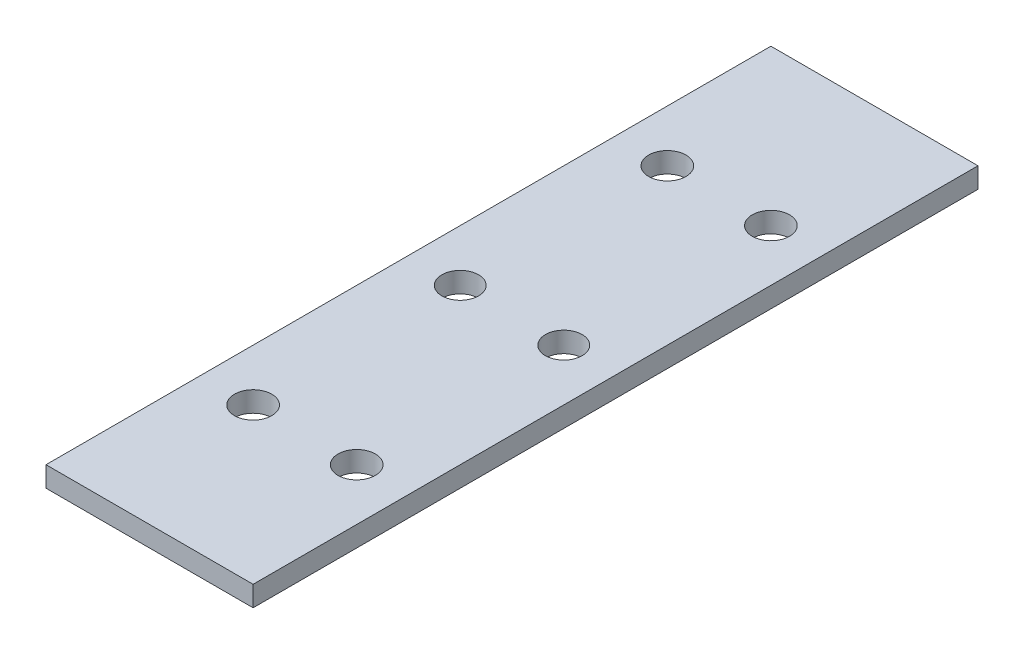
from build123d import *

# Parameters (mm, degrees)
SKETCH1_W           = 25.4
SKETCH1_H           = 88.9
SKETCH1_R           = 2.286
SKETCH1_R_2         = 2.25
BOSS_EXTRUDE1_DEPTH = 2.5


with BuildPart() as part:
    # Sketch1 → Boss-Extrude1 (new body)
    with BuildSketch(Plane(origin=(0, 0, 0), x_dir=(1, 0, 0), z_dir=(0, 1, 0))):
        with Locations((12.7, 44.45)):
            Rectangle(SKETCH1_W, SKETCH1_H)
        with Locations(Location((6.35, 69.85, 0), (0, 0, 270))):
            Circle(SKETCH1_R, mode=Mode.SUBTRACT)
        with Locations(Location((19.05, 69.85, 0), (0, 0, 270))):
            Circle(SKETCH1_R, mode=Mode.SUBTRACT)
        with Locations(Location((19.05, 19.05, 0), (0, 0, 270))):
            Circle(SKETCH1_R, mode=Mode.SUBTRACT)
        with Locations(Location((6.35, 19.05, 0), (0, 0, 270))):
            Circle(SKETCH1_R, mode=Mode.SUBTRACT)
        with Locations(Location((6.35, 44.45, 0), (0, 0, 270))):
            Circle(SKETCH1_R_2, mode=Mode.SUBTRACT)
        with Locations(Location((19.05, 44.45, 0), (0, 0, 270))):
            Circle(SKETCH1_R_2, mode=Mode.SUBTRACT)
    extrude(amount=BOSS_EXTRUDE1_DEPTH)


solid = part.part
